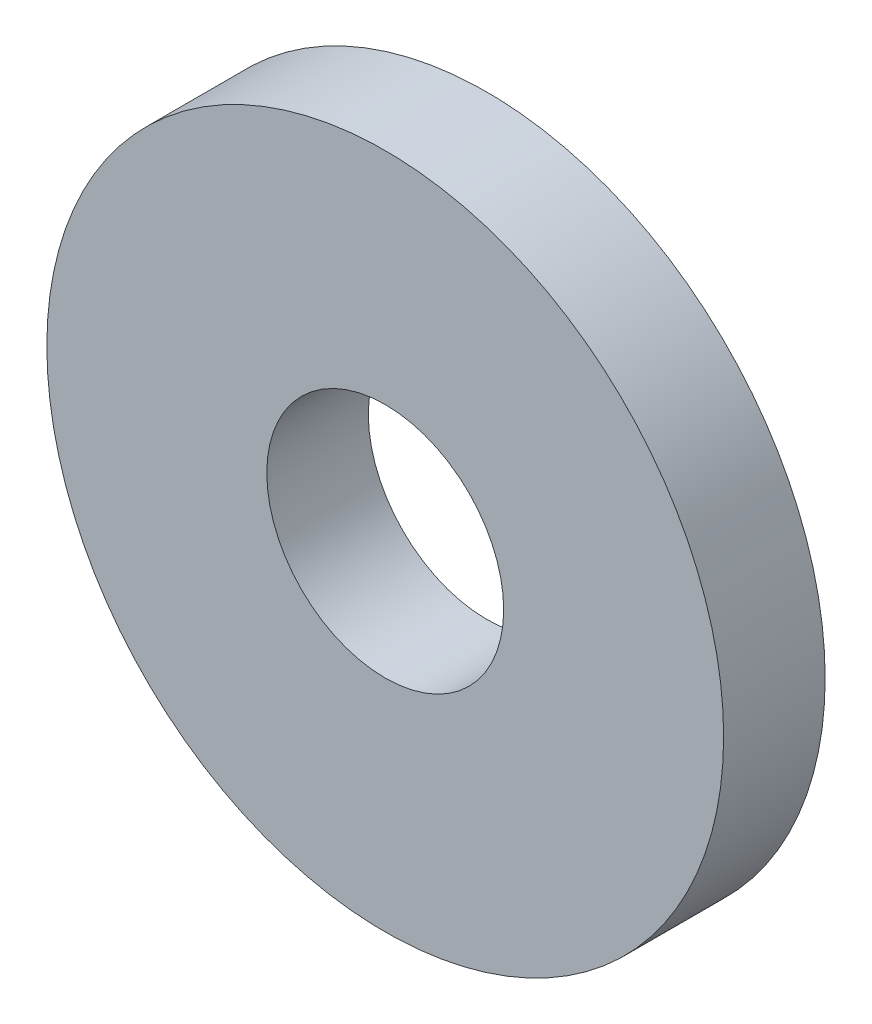
from build123d import *

# Parameters (mm, degrees)
SKETCH1_R           = 10
SKETCH1_R_2         = 3.5
BOSS_EXTRUDE1_DEPTH = 3


with BuildPart() as part:
    # Sketch1 → Boss-Extrude1 (new body)
    with BuildSketch(Plane.XY):
        Circle(SKETCH1_R)
        Circle(SKETCH1_R_2, mode=Mode.SUBTRACT)
    extrude(amount=BOSS_EXTRUDE1_DEPTH)


solid = part.part
